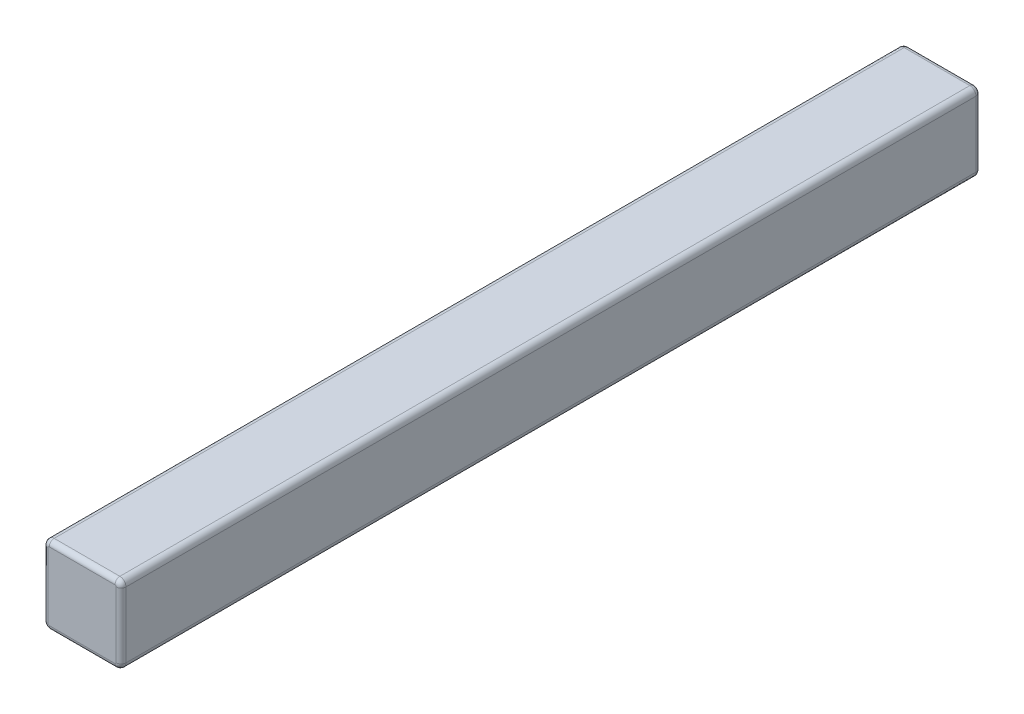
from build123d import *

# Parameters (mm, degrees)
BOSS_EXTRUDE1_DEPTH = 35
FILLET1_R           = 0.2


with BuildPart() as part:
    # Sketch1 → Boss-Extrude1 (new body)
    with BuildSketch(Plane.XY):
        with BuildLine():
            Line((-1.3375, 1.5875), (1.3375, 1.5875))
            ThreePointArc((1.3375, 1.5875), (1.514276695, 1.514276695), (1.5875, 1.3375))
            Line((1.5875, 1.3375), (1.5875, -1.3375))
            ThreePointArc((1.5875, -1.3375), (1.514276695, -1.514276695), (1.3375, -1.5875))
            Line((1.3375, -1.5875), (-1.3375, -1.5875))
            ThreePointArc((-1.3375, -1.5875), (-1.514276695, -1.514276695), (-1.5875, -1.3375))
            Line((-1.5875, -1.3375), (-1.5875, 1.3375))
            ThreePointArc((-1.5875, 1.3375), (-1.514276695, 1.514276695), (-1.3375, 1.5875))
        make_face()
    extrude(amount=BOSS_EXTRUDE1_DEPTH)

    # Fillet1
    fillet1_edges = [part.edges().sort_by_distance(p)[0] for p in [
        (-1.5875, 0, 0),
        (-1.514276695, -1.514276695, 0),
        (0, -1.5875, 0),
        (1.514276695, -1.514276695, 0),
        (1.5875, 0, 0),
        (1.514276695, 1.514276695, 0),
        (0, 1.5875, 0),
        (-1.514276695, 1.514276695, 0),
        (0, 1.5875, 35),
        (1.514276695, 1.514276695, 35),
        (1.5875, 0, 35),
        (1.514276695, -1.514276695, 35),
        (0, -1.5875, 35),
        (-1.514276695, -1.514276695, 35),
        (-1.5875, 0, 35),
        (-1.514276695, 1.514276695, 35),
    ]]
    fillet(fillet1_edges, radius=FILLET1_R)


solid = part.part
